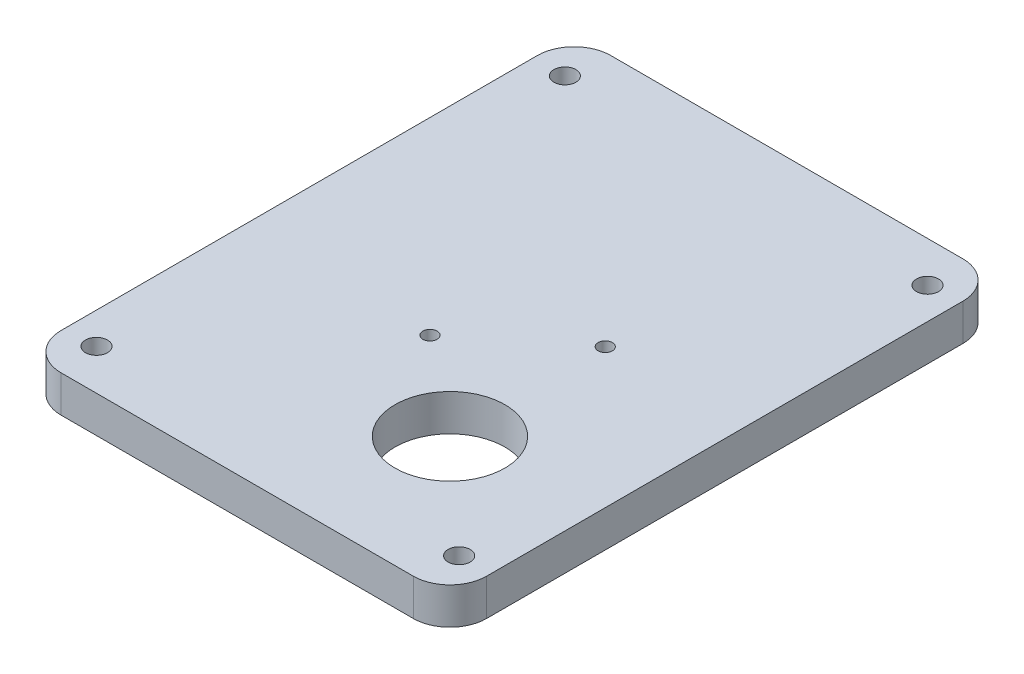
from build123d import *

# Parameters (mm, degrees)
SKETCH1_W           = 58
SKETCH1_H           = 74.913224731
SKETCH1_R           = 0.975
SKETCH1_R_2         = 3.2
BOSS_EXTRUDE1_DEPTH = 5
FILLET1_R           = 5
SKETCH6_R           = 1.5
CUT_EXTRUDE9_DEPTH  = 14
SKETCH7_R           = 7.49
CUT_EXTRUDE10_DEPTH = 5


with BuildPart() as part:
    # Sketch1 → Boss-Extrude1 (new body)
    with BuildSketch(Plane(origin=(0, 0, 0), x_dir=(1, 0, 0), z_dir=(0, 1, 0))):
        with Locations((0, -16.456612366)):
            Rectangle(SKETCH1_W, SKETCH1_H)
        with Locations(Location((10, -13.747727085, 0), (0, 0, 270))):
            Circle(SKETCH1_R, mode=Mode.SUBTRACT)
        with Locations(Location((-3.304338666, -24.330475908, 0), (0, 0, 270))):
            Circle(SKETCH1_R, mode=Mode.SUBTRACT)
        with Locations(Location((10, -34.913224731, 0), (0, 0, 270))):
            Circle(SKETCH1_R_2, mode=Mode.SUBTRACT)
    extrude(amount=BOSS_EXTRUDE1_DEPTH)

    # Fillet1
    fillet1_edges = [part.edges().sort_by_distance(p)[0] for p in [
        (29, 2.5, 53.913224731),
        (-29, 2.5, 53.913224731),
        (-29, 2.5, -21),
        (29, 2.5, -21),
    ]]
    fillet(fillet1_edges, radius=FILLET1_R)

    # Sketch6 → Cut-Extrude9 (cut)
    with BuildSketch(Plane(origin=(0, 0, 0), x_dir=(1, 0, 0), z_dir=(0, 1, 0))):
        with Locations(Location((24.71466455, 15.465029351, 0), (0, 0, 90))):
            Circle(SKETCH6_R)
        with Locations(Location((-24.71466455, 15.465029351, 0), (0, 0, 90))):
            Circle(SKETCH6_R)
        with Locations(Location((24.71466455, -48.378254082, 0), (0, 0, 90))):
            Circle(SKETCH6_R)
        with Locations(Location((-24.71466455, -48.378254082, 0), (0, 0, 90))):
            Circle(SKETCH6_R)
    extrude(amount=CUT_EXTRUDE9_DEPTH, mode=Mode.SUBTRACT)

    # Sketch7 → Cut-Extrude10 (cut)
    with BuildSketch(Plane(origin=(0, 0, 0), x_dir=(1, 0, 0), z_dir=(0, 1, 0))):
        with Locations(Location((10, -34.913224731, 0), (0, 0, 270))):
            Circle(SKETCH7_R)
    extrude(amount=CUT_EXTRUDE10_DEPTH, mode=Mode.SUBTRACT)


solid = part.part
